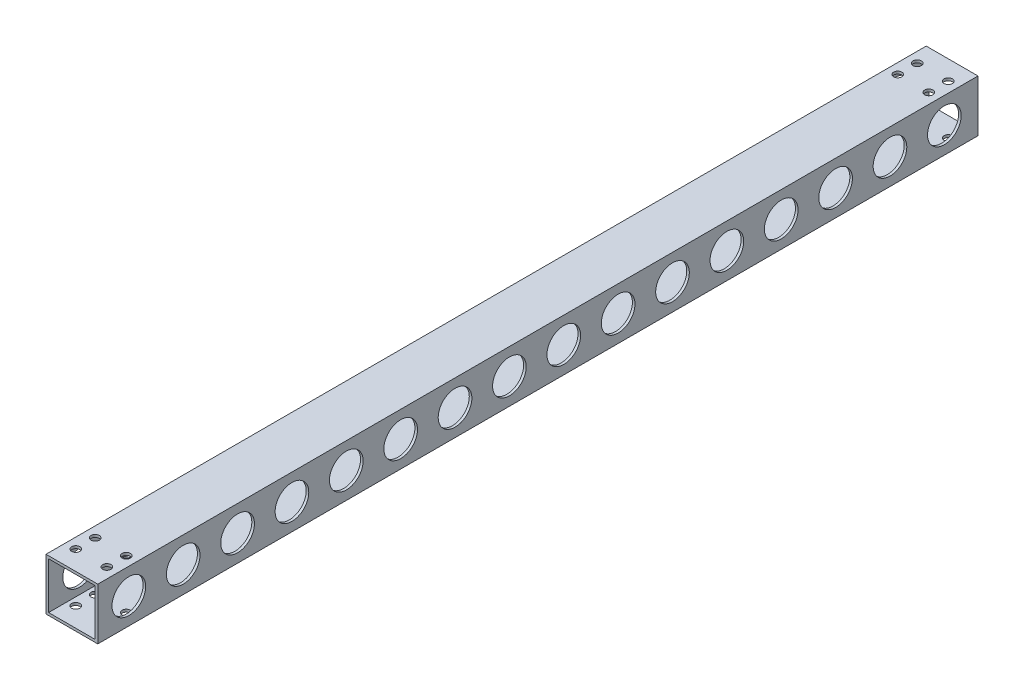
from build123d import *

# Parameters (mm, degrees)
SKETCH_2_W          = 20
SKETCH_2_H          = 20
SKETCH_2_W_2        = 18
SKETCH_2_H_2        = 18
EXTRUDE_1_DEPTH     = 340
SKETCH_3_R          = 1.6
CUT_EXTRUDE_1_DEPTH = 342.174442185
SKETCH_4_R          = 6.5
CUT_EXTRUDE_2_DEPTH = 342.174442185


with BuildPart() as part:
    # 草图2 → 凸台-拉伸1 (new body)
    with BuildSketch(Plane.XY):
        with Locations((10, 10)):
            Rectangle(SKETCH_2_W, SKETCH_2_H)
        with Locations((10, 10)):
            Rectangle(SKETCH_2_W_2, SKETCH_2_H_2, mode=Mode.SUBTRACT)
    extrude(amount=EXTRUDE_1_DEPTH)

    # 草图3 → 切除-拉伸1 (cut, through all)
    with BuildSketch(Plane.XZ):
        with Locations(Location((16, 332.5, 0), (0, 0, 270))):
            Circle(SKETCH_3_R)
        with Locations(Location((4, 332.5, 0), (0, 0, 270))):
            Circle(SKETCH_3_R)
        with Locations(Location((16, 325, 0), (0, 0, 270))):
            Circle(SKETCH_3_R)
        with Locations(Location((4, 325, 0), (0, 0, 270))):
            Circle(SKETCH_3_R)
        with Locations(Location((16, 7.5, 0), (0, 0, 270))):
            Circle(SKETCH_3_R)
        with Locations(Location((4, 7.5, 0), (0, 0, 270))):
            Circle(SKETCH_3_R)
        with Locations(Location((16, 15, 0), (0, 0, 270))):
            Circle(SKETCH_3_R)
        with Locations(Location((4, 15, 0), (0, 0, 270))):
            Circle(SKETCH_3_R)
    extrude(amount=-CUT_EXTRUDE_1_DEPTH, mode=Mode.SUBTRACT)

    # 草图4 → 切除-拉伸2 (cut, through all)
    with BuildSketch(Plane(origin=(20, 0, 0), x_dir=(0, 0, -1), z_dir=(1, 0, 0))):
        with Locations((-328, 10)):
            Circle(SKETCH_4_R)
        with Locations((-307, 10)):
            Circle(SKETCH_4_R)
        with Locations((-286, 10)):
            Circle(SKETCH_4_R)
        with Locations((-265, 10)):
            Circle(SKETCH_4_R)
        with Locations((-244, 10)):
            Circle(SKETCH_4_R)
        with Locations((-223, 10)):
            Circle(SKETCH_4_R)
        with Locations((-202, 10)):
            Circle(SKETCH_4_R)
        with Locations((-181, 10)):
            Circle(SKETCH_4_R)
        with Locations((-160, 10)):
            Circle(SKETCH_4_R)
        with Locations((-139, 10)):
            Circle(SKETCH_4_R)
        with Locations((-118, 10)):
            Circle(SKETCH_4_R)
        with Locations((-97, 10)):
            Circle(SKETCH_4_R)
        with Locations((-76, 10)):
            Circle(SKETCH_4_R)
        with Locations((-55, 10)):
            Circle(SKETCH_4_R)
        with Locations((-34, 10)):
            Circle(SKETCH_4_R)
        with Locations((-13, 10)):
            Circle(SKETCH_4_R)
    extrude(amount=-CUT_EXTRUDE_2_DEPTH, mode=Mode.SUBTRACT)


solid = part.part
